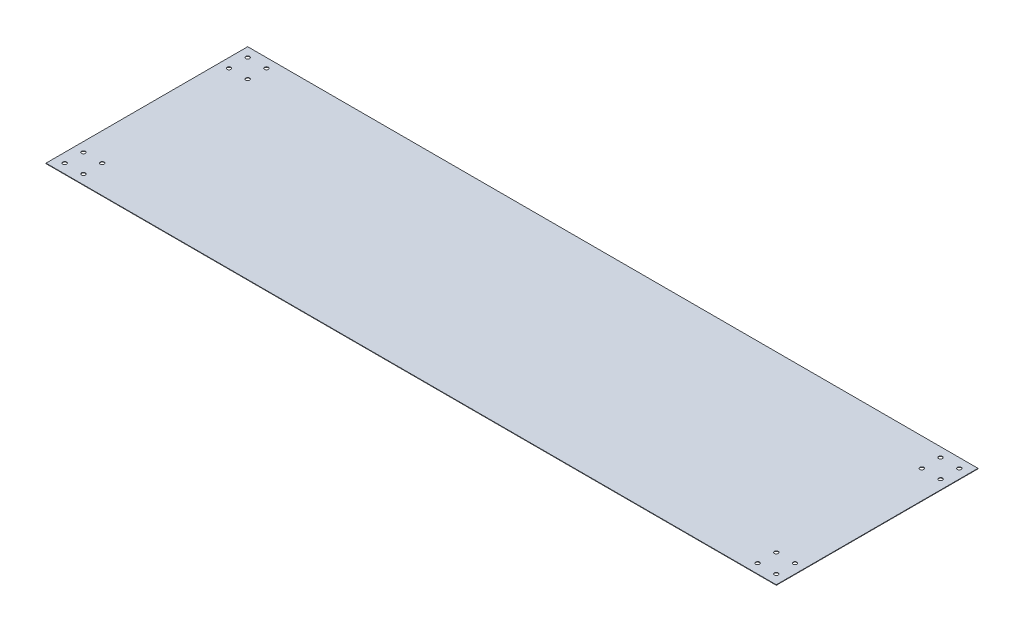
from build123d import *

# Parameters (mm, degrees)
SKETCH1_W           = 1560.01
SKETCH1_H           = 430.85
SKETCH1_R           = 4.1
BOSS_EXTRUDE1_DEPTH = 1


with BuildPart() as part:
    # Sketch1 → Boss-Extrude1 (new body)
    with BuildSketch(Plane(origin=(0, 0, 0), x_dir=(1, 0, 0), z_dir=(0, 1, 0))):
        Rectangle(SKETCH1_W, SKETCH1_H)
        with Locations(Location((-760.005, 195.425, 0), (0, 0, 270))):
            Circle(SKETCH1_R, mode=Mode.SUBTRACT)
        with Locations(Location((-720.005, 195.425, 0), (0, 0, 270))):
            Circle(SKETCH1_R, mode=Mode.SUBTRACT)
        with Locations(Location((-720.005, 155.425, 0), (0, 0, 270))):
            Circle(SKETCH1_R, mode=Mode.SUBTRACT)
        with Locations(Location((-760.005, 155.425, 0), (0, 0, 270))):
            Circle(SKETCH1_R, mode=Mode.SUBTRACT)
        with Locations(Location((-760.005, -195.425, 0), (0, 0, 270))):
            Circle(SKETCH1_R, mode=Mode.SUBTRACT)
        with Locations(Location((-760.005, -155.425, 0), (0, 0, 270))):
            Circle(SKETCH1_R, mode=Mode.SUBTRACT)
        with Locations(Location((-720.005, -155.425, 0), (0, 0, 270))):
            Circle(SKETCH1_R, mode=Mode.SUBTRACT)
        with Locations(Location((-720.005, -195.425, 0), (0, 0, 270))):
            Circle(SKETCH1_R, mode=Mode.SUBTRACT)
        with Locations(Location((720.005, -195.425, 0), (0, 0, 270))):
            Circle(SKETCH1_R, mode=Mode.SUBTRACT)
        with Locations(Location((760.005, -195.425, 0), (0, 0, 270))):
            Circle(SKETCH1_R, mode=Mode.SUBTRACT)
        with Locations(Location((760.005, -155.425, 0), (0, 0, 270))):
            Circle(SKETCH1_R, mode=Mode.SUBTRACT)
        with Locations(Location((720.005, -155.425, 0), (0, 0, 270))):
            Circle(SKETCH1_R, mode=Mode.SUBTRACT)
        with Locations(Location((760.005, 155.425, 0), (0, 0, 270))):
            Circle(SKETCH1_R, mode=Mode.SUBTRACT)
        with Locations(Location((760.005, 195.425, 0), (0, 0, 270))):
            Circle(SKETCH1_R, mode=Mode.SUBTRACT)
        with Locations(Location((720.005, 155.425, 0), (0, 0, 270))):
            Circle(SKETCH1_R, mode=Mode.SUBTRACT)
        with Locations(Location((720.005, 195.425, 0), (0, 0, 270))):
            Circle(SKETCH1_R, mode=Mode.SUBTRACT)
    extrude(amount=BOSS_EXTRUDE1_DEPTH)


solid = part.part
